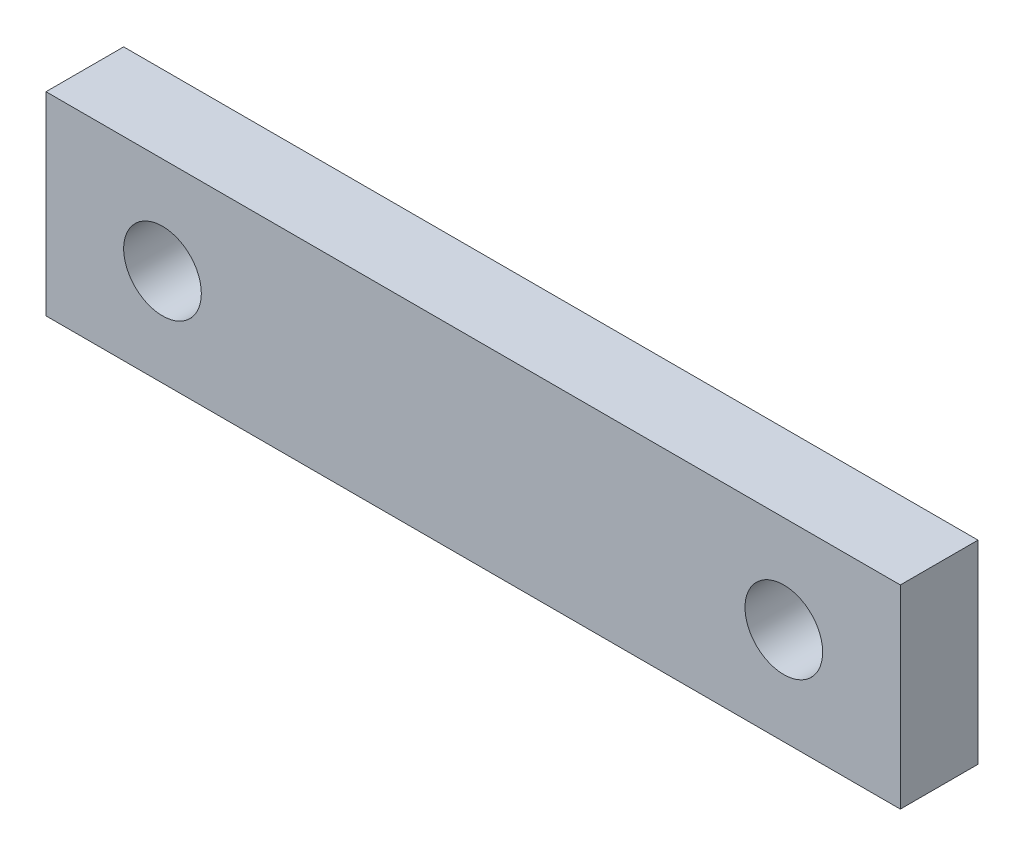
from build123d import *

# Parameters (mm, degrees)
SKETCH1_W           = 279.4
SKETCH1_H           = 63.5
BOSS_EXTRUDE1_DEPTH = 25.4
SKETCH5_R           = 12.7
CUT_EXTRUDE2_DEPTH  = 224.088622337
SKETCH4_R           = 12.7
CUT_EXTRUDE3_DEPTH  = 224.088622337


with BuildPart() as part:
    # Sketch1 → Boss-Extrude1 (new body)
    with BuildSketch(Plane.XY):
        with Locations((76.743203482, 15.954434625)):
            Rectangle(SKETCH1_W, SKETCH1_H)
    extrude(amount=BOSS_EXTRUDE1_DEPTH)

    # Sketch5 → Cut-Extrude2 (cut, through all)
    with BuildSketch(Plane.XY.offset(25.4)):
        with Locations((178.343203482, 15.954434625)):
            Circle(SKETCH5_R)
    extrude(amount=-CUT_EXTRUDE2_DEPTH, mode=Mode.SUBTRACT)

    # Sketch4 → Cut-Extrude3 (cut, through all)
    with BuildSketch(Plane.XY.offset(25.4)):
        with Locations((-24.856796518, 15.954434625)):
            Circle(SKETCH4_R)
    extrude(amount=-CUT_EXTRUDE3_DEPTH, mode=Mode.SUBTRACT)


solid = part.part
